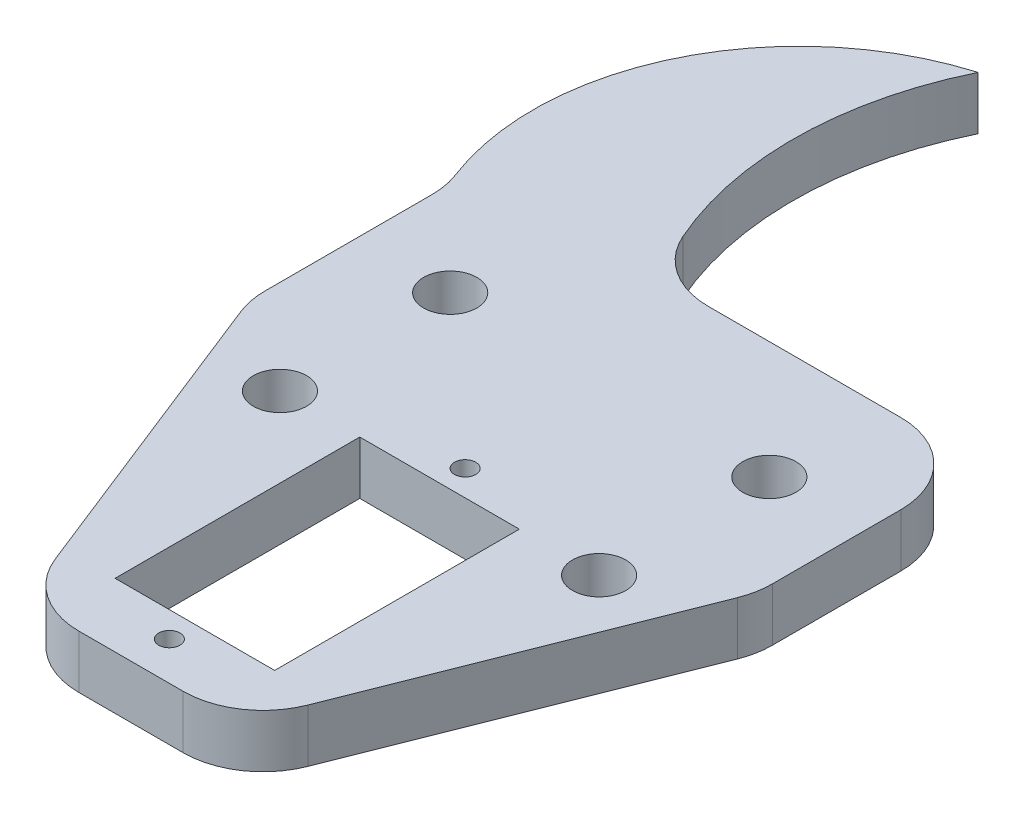
from build123d import *

# Parameters (mm, degrees)
SKETCH1_R           = 25
BOSS_EXTRUDE1_DEPTH = 5
CUT_EXTRUDE1_START  = -5
CUT_EXTRUDE1_DEPTH  = 5
BOSS_EXTRUDE2_START = -5
BOSS_EXTRUDE2_DEPTH = 5
SKETCH7_W           = 20
SKETCH7_H           = 35
SKETCH7_R           = 1
SKETCH7_W_2         = 15
SKETCH7_H_2         = 23
BOSS_EXTRUDE3_DEPTH = 5
BOSS_EXTRUDE4_DEPTH = 5
SKETCH10_R          = 2.5
CUT_EXTRUDE3_DEPTH  = 5
FILLET3_R           = 7.5


with BuildPart() as part:
    # Sketch1 → Boss-Extrude1 (new body)
    with BuildSketch(Plane(origin=(0, 0, 0), x_dir=(1, 0, 0), z_dir=(0, 1, 0))):
        Circle(SKETCH1_R)
    extrude(amount=BOSS_EXTRUDE1_DEPTH)

    # Sketch2 → Cut-Extrude1 (cut)
    with BuildSketch(Plane(origin=(0, 5, 0), x_dir=(1, 0, 0), z_dir=(0, 1, 0)).offset(CUT_EXTRUDE1_START)):
        with BuildLine():
            ThreePointArc((12.986967165, -21.362085195), (21.790756975, -12.2540977), (25, 0))
            ThreePointArc((25, 0), (14.944215283, 20.041717231), (-7.133634365, 23.960618956))
            ThreePointArc((-7.133634365, 23.960618956), (-7.596668184, -3.37247162), (12.986967165, -21.362085195))
        make_face()
    extrude(amount=CUT_EXTRUDE1_DEPTH, mode=Mode.SUBTRACT)

    # Sketch4 → Boss-Extrude2 (add)
    with BuildSketch(Plane(origin=(0, 5, 0), x_dir=(1, 0, 0), z_dir=(0, 1, 0)).offset(BOSS_EXTRUDE2_START)):
        with BuildLine():
            Line((24.840469341, -7.763428106), (-5.227737426, -7.763428106))
            ThreePointArc((-5.227737426, -7.763428106), (2.650074831, -16.20966255), (12.986967165, -21.362085195))
            ThreePointArc((12.986967165, -21.362085195), (-7.468591232, -23.858334917), (-22.849556978, -10.143852617))
            Line((-22.849556978, -10.143852617), (-22.849556978, -28.782420825))
            Line((-22.849556978, -28.782420825), (24.840469341, -28.782420825))
            Line((24.840469341, -28.782420825), (24.840469341, -7.763428106))
        make_face()
    extrude(amount=BOSS_EXTRUDE2_DEPTH)

    # Sketch7 → Boss-Extrude3 (add)
    with BuildSketch(Plane(origin=(0, 5, 0), x_dir=(1, 0, 0), z_dir=(0, 1, 0))):
        with Locations((0.995456182, -46.282420825)):
            Rectangle(SKETCH7_W, SKETCH7_H)
        with Locations((0.995456182, -60.182420825)):
            Circle(SKETCH7_R, mode=Mode.SUBTRACT)
        with Locations((0.995456182, -32.382420825)):
            Circle(SKETCH7_R, mode=Mode.SUBTRACT)
        with Locations((0.995456182, -46.282420825)):
            Rectangle(SKETCH7_W_2, SKETCH7_H_2, mode=Mode.SUBTRACT)
    extrude(amount=-BOSS_EXTRUDE3_DEPTH)

    # Sketch9 → Boss-Extrude4 (add)
    with BuildSketch(Plane(origin=(0, 5, 0), x_dir=(1, 0, 0), z_dir=(0, 1, 0))):
        Polygon((-9.004543818, -28.782420825), (-22.849556978, -28.782420825), (-9.004543818, -63.782420825), align=None)
        Polygon((10.995456182, -28.782420825), (10.995456182, -63.782420825), (24.840469341, -28.782420825), align=None)
    extrude(amount=-BOSS_EXTRUDE4_DEPTH)

    # Sketch10 → Cut-Extrude3 (cut)
    with BuildSketch(Plane(origin=(0, 5, 0), x_dir=(1, 0, 0), z_dir=(0, 1, 0))):
        with Locations((15.995456182, -34.782420825)):
            Circle(SKETCH10_R)
        with Locations((-14.004543818, -34.782420825)):
            Circle(SKETCH10_R)
        with Locations((15.995456182, -18.782420825)):
            Circle(SKETCH10_R)
        with Locations((-14.004543818, -18.782420825)):
            Circle(SKETCH10_R)
    extrude(amount=-CUT_EXTRUDE3_DEPTH, mode=Mode.SUBTRACT)

    # Fillet3
    fillet3_edges = [part.edges().sort_by_distance(p)[0] for p in [
        (-22.849556978, 2.5, 10.143852617),
        (-22.849556978, 2.5, 28.782420825),
        (10.995456182, 2.5, 63.782420825),
        (-9.004543818, 2.5, 63.782420825),
        (24.840469341, 2.5, 28.782420825),
        (24.840469341, 2.5, 7.763428106),
        (-5.227737426, 2.5, 7.763428106),
    ]]
    fillet(fillet3_edges, radius=FILLET3_R)


solid = part.part
